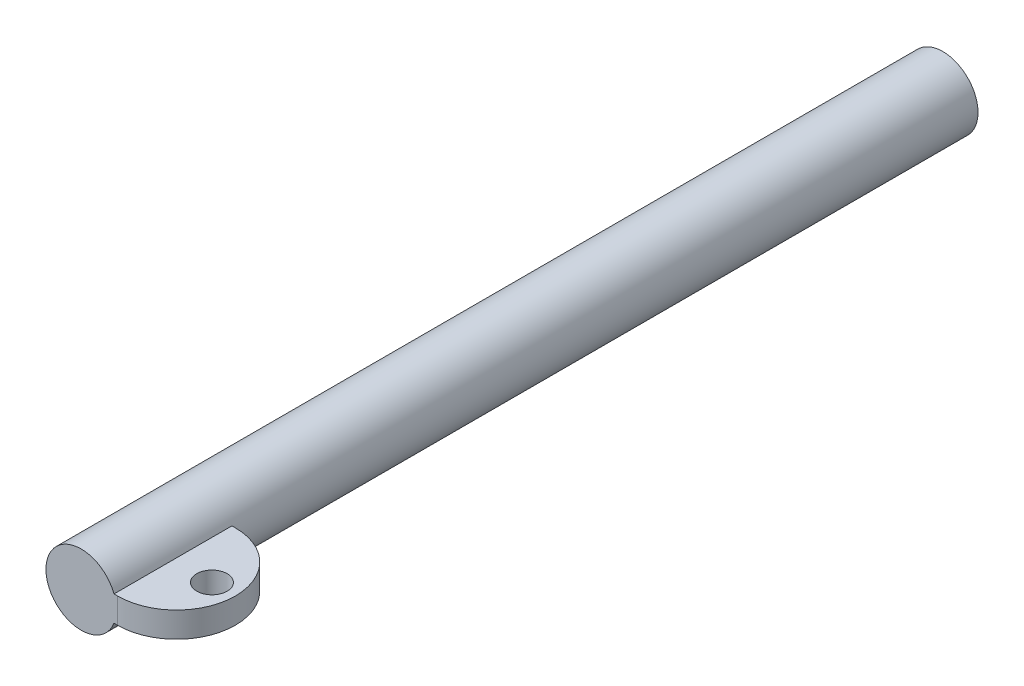
from build123d import *

# Parameters (mm, degrees)
SKETCH1_R                = 17.653
BASE_EXTRUDE_DEPTH       = 431.8
BOSS_EXTRUDE1_DEPTH      = 6.35
BOSS_EXTRUDE1_DEPTH_BACK = 6.35
SKETCH4_R                = 7.62


with BuildPart() as part:
    # Sketch1 → Base-Extrude (new body)
    with BuildSketch(Plane.XY):
        Circle(SKETCH1_R)
    extrude(amount=-BASE_EXTRUDE_DEPTH)

    # Sketch4 → Boss-Extrude1 (add, two sides: drawn at the far end of the back side and taken through both)
    with BuildSketch(Plane(origin=(0, 0, 0), x_dir=(-1, 0, 0), z_dir=(0, 1, 0)).offset(-BOSS_EXTRUDE1_DEPTH_BACK)):
        with BuildLine():
            Line((-9.256612772, -59.074644757), (-9.256612772, 0))
            Line((-9.256612772, 0), (-18.231166151, 0))
            ThreePointArc((-18.231166151, 0), (-47.768488529, -29.537322378), (-18.231166151, -59.074644757))
            Line((-18.231166151, -59.074644757), (-9.256612772, -59.074644757))
        make_face()
        with Locations(Location((-36.011166151, -29.537322378, 0), (0, 0, 90))):
            Circle(SKETCH4_R, mode=Mode.SUBTRACT)
    extrude(amount=BOSS_EXTRUDE1_DEPTH + BOSS_EXTRUDE1_DEPTH_BACK)


solid = part.part
